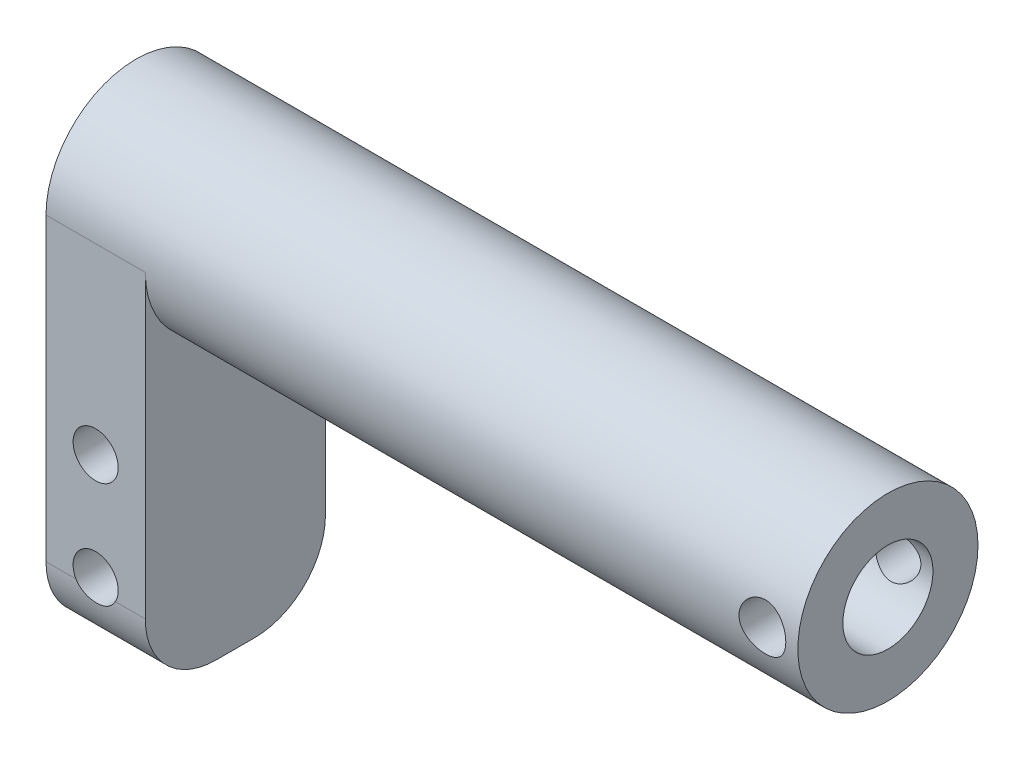
from build123d import *

# Parameters (mm, degrees)
SKETCH1_R             = 6.35
SKETCH1_R_2           = 3.175
BOSS_EXTRUDE1_DEPTH   = 53
SKETCH1_3_R           = 3.175
SKETCH1_3_R_2         = 3
BOSS_EXTRUDE2_DEPTH   = 7
M4X0_7_TAPPED_HOLE1_D = 3.3
BOSS_EXTRUDE3_DEPTH   = 7
FILLET2_R             = 5
SKETCH11_R            = 1.59
CUT_EXTRUDE5_DEPTH    = 61.453582302
CUT_EXTRUDE6_DEPTH    = 15


with BuildPart() as part:
    # Sketch1 → Boss-Extrude1 (new body)
    with BuildSketch(Plane.YZ):
        Circle(SKETCH1_R)
        Circle(SKETCH1_R_2, mode=Mode.SUBTRACT)
    extrude(amount=BOSS_EXTRUDE1_DEPTH)

    # Sketch1<3> → Boss-Extrude2 (add)
    with BuildSketch(Plane.YZ):
        Circle(SKETCH1_3_R)
        Circle(SKETCH1_3_R_2, mode=Mode.SUBTRACT)
    extrude(amount=BOSS_EXTRUDE2_DEPTH)

    # M4x0.7 Tapped Hole1 (through all)
    with Locations(Plane(origin=(0, 0, 6.35), x_dir=(0, 1, 0), z_dir=(0, 0, 1))):
        with Locations((0, -50.5)):
            Hole(M4X0_7_TAPPED_HOLE1_D / 2)

    # Sketch10 → Boss-Extrude3 (add)
    with BuildSketch(Plane(origin=(0, 0, 0), x_dir=(0, -1, 0), z_dir=(-1, 0, 0))):
        with BuildLine():
            Line((26.16, 6.35), (0, 6.35))
            ThreePointArc((0, 6.35), (6.35, 0), (0, -6.35))
            Line((0, -6.35), (26.16, -6.35))
            Line((26.16, -6.35), (26.16, 6.35))
        make_face()
    extrude(amount=-BOSS_EXTRUDE3_DEPTH)

    # Fillet2
    fillet2_edges = [part.edges().sort_by_distance(p)[0] for p in [
        (3.5, -26.16, 6.35),
        (3.5, -26.16, -6.35),
    ]]
    fillet(fillet2_edges, radius=FILLET2_R)

    # Sketch11 → Cut-Extrude5 (cut, through all)
    with BuildSketch(Plane(origin=(0, 0, -6.35), x_dir=(1, 0, 0), z_dir=(0, 0, -1))):
        with Locations((3.5, 20.38)):
            Circle(SKETCH11_R)
        with Locations((3.5, 12.88)):
            Circle(SKETCH11_R)
    extrude(amount=-CUT_EXTRUDE5_DEPTH, mode=Mode.SUBTRACT)

    # Sketch14 → Cut-Extrude6 (cut)
    with BuildSketch(Plane.ZY):
        with BuildLine():
            Line((0.394195268, -3.844294872), (0.511152831, -3.259062998))
            ThreePointArc((0.511152831, -3.259062998), (0.551737931, -3.219580053), (0.603153546, -3.243296878))
            Line((0.603153546, -3.243296878), (0.90829688, -3.756193519))
            ThreePointArc((0.90829688, -3.756193519), (0.932155167, -3.776831916), (0.963621249, -3.779078471))
            ThreePointArc((0.963621249, -3.779078471), (1.132224679, -3.732032593), (1.298547251, -3.677468564))
            Line((1.298547251, -3.677468564), (1.333878559, -3.664801221))
            ThreePointArc((1.333878559, -3.664801221), (1.496981223, -3.601256339), (1.65706823, -3.530456752))
            ThreePointArc((1.65706823, -3.530456752), (1.679938755, -3.50872888), (1.685248668, -3.477632801))
            Line((1.685248668, -3.477632801), (1.594991737, -2.887692885))
            ThreePointArc((1.594991737, -2.887692885), (1.619625293, -2.836710131), (1.676051799, -2.841411481))
            Line((1.676051799, -2.841411481), (2.138213721, -3.219011503))
            ThreePointArc((2.138213721, -3.219011503), (2.167691925, -3.230245238), (2.198028737, -3.221594275))
            ThreePointArc((2.198028737, -3.221594275), (2.340373498, -3.119719841), (2.478003595, -3.011560756))
            Line((2.478003595, -3.011560756), (2.506871678, -2.987573328))
            ThreePointArc((2.506871678, -2.987573328), (2.638404418, -2.872076274), (2.764622113, -2.750793444))
            ThreePointArc((2.764622113, -2.750793444), (2.778682006, -2.722553743), (2.773036206, -2.69151689))
            Line((2.773036206, -2.69151689), (2.4864511, -2.168024393))
            ThreePointArc((2.4864511, -2.168024393), (2.492161942, -2.111691103), (2.54679347, -2.096809925))
            Line((2.54679347, -2.096809925), (3.110230431, -2.293569192))
            ThreePointArc((3.110230431, -2.293569192), (3.141773045, -2.29404331), (3.16732152, -2.275538263))
            ThreePointArc((3.16732152, -2.275538263), (3.266238734, -2.131122834), (3.358576134, -1.982414274))
            Line((3.358576134, -1.982414274), (3.377499075, -1.95))
            ThreePointArc((3.377499075, -1.95), (3.461597101, -1.796481424), (3.538721767, -1.63934385))
            ThreePointArc((3.538721767, -1.63934385), (3.542275198, -1.607998444), (3.526354653, -1.58076432))
            Line((3.526354653, -1.58076432), (3.078007764, -1.186860162))
            ThreePointArc((3.078007764, -1.186860162), (3.06410708, -1.131970962), (3.110354261, -1.099302146))
            Line((3.110354261, -1.099302146), (3.707107449, -1.091488587))
            ThreePointArc((3.707107449, -1.091488587), (3.736909969, -1.081145903), (3.754588583, -1.055018754))
            ThreePointArc((3.754588583, -1.055018754), (3.798147373, -0.885480962), (3.834054823, -0.714159374))
            Line((3.834054823, -0.714159374), (3.840750237, -0.677227893))
            ThreePointArc((3.840750237, -0.677227893), (3.867270087, -0.504204401), (3.88599935, -0.330165193))
            ThreePointArc((3.88599935, -0.330165193), (3.878617723, -0.299494801), (3.854342685, -0.279348243))
            Line((3.854342685, -0.279348243), (3.298311265, -0.062543079))
            ThreePointArc((3.298311265, -0.062543079), (3.266475683, -0.015718417), (3.298760425, 0.030797696))
            Line((3.298760425, 0.030797696), (3.856852597, 0.24224165))
            ThreePointArc((3.856852597, 0.24224165), (3.881320399, 0.262153656), (3.888996851, 0.292751587))
            ThreePointArc((3.888996851, 0.292751587), (3.871943384, 0.466962983), (3.847089917, 0.640233686))
            Line((3.847089917, 0.640233686), (3.840750237, 0.677227893))
            ThreePointArc((3.840750237, 0.677227893), (3.806493224, 0.848887114), (3.76456806, 1.018836259))
            ThreePointArc((3.76456806, 1.018836259), (3.747141708, 1.045132335), (3.717440105, 1.055761355))
            Line((3.717440105, 1.055761355), (3.12078975, 1.069317621))
            ThreePointArc((3.12078975, 1.069317621), (3.074859111, 1.102430001), (3.089287397, 1.157182881))
            Line((3.089287397, 1.157182881), (3.541404401, 1.546753969))
            ThreePointArc((3.541404401, 1.546753969), (3.557586307, 1.573833615), (3.554334703, 1.605211767))
            ThreePointArc((3.554334703, 1.605211767), (3.47872588, 1.763084301), (3.396109189, 1.917405115))
            Line((3.396109189, 1.917405115), (3.377499075, 1.95))
            ThreePointArc((3.377499075, 1.95), (3.286597101, 2.099590315), (3.189074303, 2.244951022))
            ThreePointArc((3.189074303, 2.244951022), (3.163705101, 2.263701087), (3.132159385, 2.263530552))
            Line((3.132159385, 2.263530552), (2.566854933, 2.072202836))
            ThreePointArc((2.566854933, 2.072202836), (2.51236915, 2.087609091), (2.507200715, 2.143994732))
            Line((2.507200715, 2.143994732), (2.798810569, 2.664704931))
            ThreePointArc((2.798810569, 2.664704931), (2.804754802, 2.695686013), (2.790967334, 2.724059717))
            ThreePointArc((2.790967334, 2.724059717), (2.665922694, 2.846551631), (2.535507572, 2.963309189))
            Line((2.535507572, 2.963309189), (2.506871678, 2.987573328))
            ThreePointArc((2.506871678, 2.987573328), (2.370288863, 3.097051938), (2.228931119, 3.200291559))
            ThreePointArc((2.228931119, 3.200291559), (2.198678968, 3.209234079), (2.169094017, 3.198284558))
            Line((2.169094017, 3.198284558), (1.703319528, 2.825149805))
            ThreePointArc((1.703319528, 2.825149805), (1.64685039, 2.820991714), (1.622708626, 2.872209177))
            Line((1.622708626, 2.872209177), (1.718638876, 3.461253152))
            ThreePointArc((1.718638876, 3.461253152), (1.713628474, 3.492398894), (1.690968114, 3.514345862))
            ThreePointArc((1.690968114, 3.514345862), (1.531569886, 3.586682825), (1.369086322, 3.651794441))
            Line((1.369086322, 3.651794441), (1.333878559, 3.664801221))
            ThreePointArc((1.333878559, 3.664801221), (1.168088806, 3.720963389), (0.999945947, 3.769629704))
            ThreePointArc((0.999945947, 3.769629704), (0.968459702, 3.767686078), (0.944403898, 3.747278245))
            Line((0.944403898, 3.747278245), (0.63433865, 3.237342014))
            ThreePointArc((0.63433865, 3.237342014), (0.582697169, 3.214121104), (0.542493927, 3.253992805))
            Line((0.542493927, 3.253992805), (0.43117397, 3.840323161))
            ThreePointArc((0.43117397, 3.840323161), (0.415813261, 3.867876925), (0.387013183, 3.88075003))
            ThreePointArc((0.387013183, 3.88075003), (0.212487146, 3.894207135), (0.037533056, 3.899819389))
            Line((0.037533056, 3.899819389), (0, 3.9))
            ThreePointArc((0, 3.9), (-0.175, 3.89607174), (-0.349647464, 3.884294872))
            ThreePointArc((-0.349647464, 3.884294872), (-0.378570097, 3.871699531), (-0.394195268, 3.844294872))
            Line((-0.394195268, 3.844294872), (-0.511152831, 3.259062998))
            ThreePointArc((-0.511152831, 3.259062998), (-0.551737931, 3.219580053), (-0.603153546, 3.243296878))
            Line((-0.603153546, 3.243296878), (-0.90829688, 3.756193519))
            ThreePointArc((-0.90829688, 3.756193519), (-0.932155167, 3.776831916), (-0.963621249, 3.779078471))
            ThreePointArc((-0.963621249, 3.779078471), (-1.132224679, 3.732032593), (-1.298547251, 3.677468564))
            Line((-1.298547251, 3.677468564), (-1.333878559, 3.664801221))
            ThreePointArc((-1.333878559, 3.664801221), (-1.496981223, 3.601256339), (-1.65706823, 3.530456752))
            ThreePointArc((-1.65706823, 3.530456752), (-1.679938755, 3.50872888), (-1.685248668, 3.477632801))
            Line((-1.685248668, 3.477632801), (-1.594991737, 2.887692885))
            ThreePointArc((-1.594991737, 2.887692885), (-1.619625293, 2.836710131), (-1.676051799, 2.841411481))
            Line((-1.676051799, 2.841411481), (-2.138213721, 3.219011503))
            ThreePointArc((-2.138213721, 3.219011503), (-2.167691925, 3.230245238), (-2.198028737, 3.221594275))
            ThreePointArc((-2.198028737, 3.221594275), (-2.340373498, 3.119719841), (-2.478003595, 3.011560756))
            Line((-2.478003595, 3.011560756), (-2.506871678, 2.987573328))
            ThreePointArc((-2.506871678, 2.987573328), (-2.638404418, 2.872076274), (-2.764622113, 2.750793444))
            ThreePointArc((-2.764622113, 2.750793444), (-2.778682006, 2.722553743), (-2.773036206, 2.69151689))
            Line((-2.773036206, 2.69151689), (-2.4864511, 2.168024393))
            ThreePointArc((-2.4864511, 2.168024393), (-2.492161942, 2.111691103), (-2.54679347, 2.096809925))
            Line((-2.54679347, 2.096809925), (-3.110230431, 2.293569192))
            ThreePointArc((-3.110230431, 2.293569192), (-3.141773045, 2.29404331), (-3.16732152, 2.275538263))
            ThreePointArc((-3.16732152, 2.275538263), (-3.266238734, 2.131122834), (-3.358576134, 1.982414274))
            Line((-3.358576134, 1.982414274), (-3.377499075, 1.95))
            ThreePointArc((-3.377499075, 1.95), (-3.461597101, 1.796481424), (-3.538721767, 1.63934385))
            ThreePointArc((-3.538721767, 1.63934385), (-3.542275198, 1.607998444), (-3.526354653, 1.58076432))
            Line((-3.526354653, 1.58076432), (-3.078007764, 1.186860162))
            ThreePointArc((-3.078007764, 1.186860162), (-3.06410708, 1.131970962), (-3.110354261, 1.099302146))
            Line((-3.110354261, 1.099302146), (-3.707107449, 1.091488587))
            ThreePointArc((-3.707107449, 1.091488587), (-3.736909969, 1.081145903), (-3.754588583, 1.055018754))
            ThreePointArc((-3.754588583, 1.055018754), (-3.798147373, 0.885480962), (-3.834054823, 0.714159374))
            Line((-3.834054823, 0.714159374), (-3.840750237, 0.677227893))
            ThreePointArc((-3.840750237, 0.677227893), (-3.867270087, 0.504204401), (-3.88599935, 0.330165193))
            ThreePointArc((-3.88599935, 0.330165193), (-3.878617723, 0.299494801), (-3.854342685, 0.279348243))
            Line((-3.854342685, 0.279348243), (-3.298311265, 0.062543079))
            ThreePointArc((-3.298311265, 0.062543079), (-3.266475683, 0.015718417), (-3.298760425, -0.030797696))
            Line((-3.298760425, -0.030797696), (-3.856852597, -0.24224165))
            ThreePointArc((-3.856852597, -0.24224165), (-3.881320399, -0.262153656), (-3.888996851, -0.292751587))
            ThreePointArc((-3.888996851, -0.292751587), (-3.871943384, -0.466962983), (-3.847089917, -0.640233686))
            Line((-3.847089917, -0.640233686), (-3.840750237, -0.677227893))
            ThreePointArc((-3.840750237, -0.677227893), (-3.806493224, -0.848887114), (-3.76456806, -1.018836259))
            ThreePointArc((-3.76456806, -1.018836259), (-3.747141708, -1.045132335), (-3.717440105, -1.055761355))
            Line((-3.717440105, -1.055761355), (-3.12078975, -1.069317621))
            ThreePointArc((-3.12078975, -1.069317621), (-3.074859111, -1.102430001), (-3.089287397, -1.157182881))
            Line((-3.089287397, -1.157182881), (-3.541404401, -1.546753969))
            ThreePointArc((-3.541404401, -1.546753969), (-3.557586307, -1.573833615), (-3.554334703, -1.605211767))
            ThreePointArc((-3.554334703, -1.605211767), (-3.47872588, -1.763084301), (-3.396109189, -1.917405115))
            Line((-3.396109189, -1.917405115), (-3.377499075, -1.95))
            ThreePointArc((-3.377499075, -1.95), (-3.286597101, -2.099590315), (-3.189074303, -2.244951022))
            ThreePointArc((-3.189074303, -2.244951022), (-3.163705101, -2.263701087), (-3.132159385, -2.263530552))
            Line((-3.132159385, -2.263530552), (-2.566854933, -2.072202836))
            ThreePointArc((-2.566854933, -2.072202836), (-2.51236915, -2.087609091), (-2.507200715, -2.143994732))
            Line((-2.507200715, -2.143994732), (-2.798810569, -2.664704931))
            ThreePointArc((-2.798810569, -2.664704931), (-2.804754802, -2.695686013), (-2.790967334, -2.724059717))
            ThreePointArc((-2.790967334, -2.724059717), (-2.665922694, -2.846551631), (-2.535507572, -2.963309189))
            Line((-2.535507572, -2.963309189), (-2.506871678, -2.987573328))
            ThreePointArc((-2.506871678, -2.987573328), (-2.370288863, -3.097051938), (-2.228931119, -3.200291559))
            ThreePointArc((-2.228931119, -3.200291559), (-2.198678968, -3.209234079), (-2.169094017, -3.198284558))
            Line((-2.169094017, -3.198284558), (-1.703319528, -2.825149805))
            ThreePointArc((-1.703319528, -2.825149805), (-1.64685039, -2.820991714), (-1.622708626, -2.872209177))
            Line((-1.622708626, -2.872209177), (-1.718638876, -3.461253152))
            ThreePointArc((-1.718638876, -3.461253152), (-1.713628474, -3.492398894), (-1.690968114, -3.514345862))
            ThreePointArc((-1.690968114, -3.514345862), (-1.531569886, -3.586682825), (-1.369086322, -3.651794441))
            Line((-1.369086322, -3.651794441), (-1.333878559, -3.664801221))
            ThreePointArc((-1.333878559, -3.664801221), (-1.168088806, -3.720963389), (-0.999945947, -3.769629704))
            ThreePointArc((-0.999945947, -3.769629704), (-0.968459702, -3.767686078), (-0.944403898, -3.747278245))
            Line((-0.944403898, -3.747278245), (-0.63433865, -3.237342014))
            ThreePointArc((-0.63433865, -3.237342014), (-0.582697169, -3.214121104), (-0.542493927, -3.253992805))
            Line((-0.542493927, -3.253992805), (-0.43117397, -3.840323161))
            ThreePointArc((-0.43117397, -3.840323161), (-0.415813261, -3.867876925), (-0.387013183, -3.88075003))
            ThreePointArc((-0.387013183, -3.88075003), (-0.212487146, -3.894207135), (-0.037533056, -3.899819389))
            Line((-0.037533056, -3.899819389), (0, -3.9))
            ThreePointArc((0, -3.9), (0.175, -3.89607174), (0.349647464, -3.884294872))
            ThreePointArc((0.349647464, -3.884294872), (0.378570097, -3.871699531), (0.394195268, -3.844294872))
        make_face()
    extrude(amount=-CUT_EXTRUDE6_DEPTH, mode=Mode.SUBTRACT)


solid = part.part
